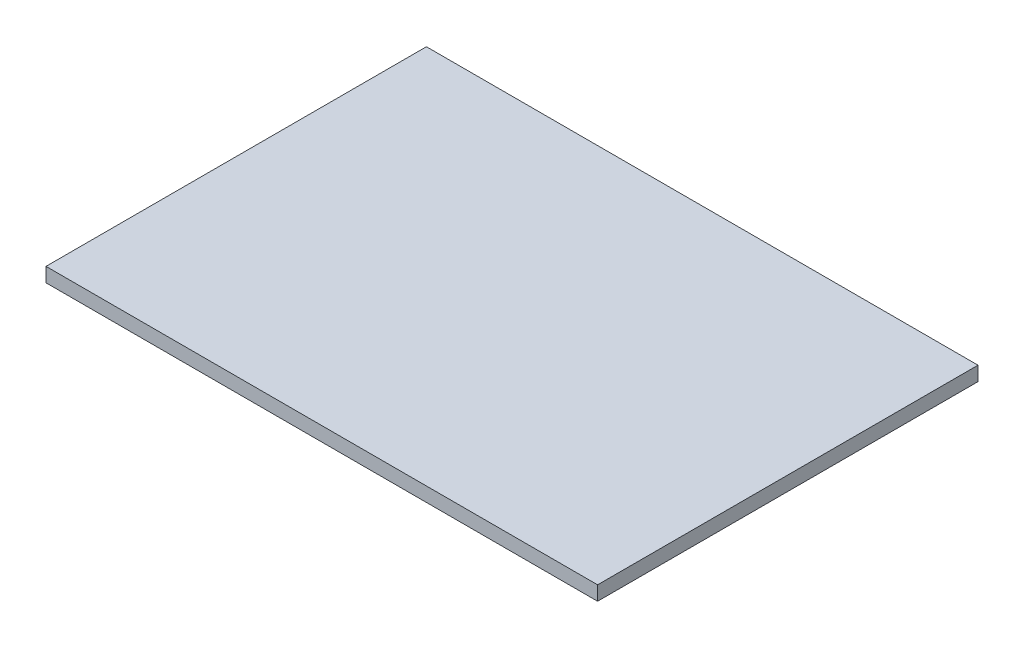
from build123d import *

# Parameters (mm, degrees)
SKETCH1_W           = 116
SKETCH1_H           = 80
BOSS_EXTRUDE1_DEPTH = 3


with BuildPart() as part:
    # Sketch1 → Boss-Extrude1 (new body)
    with BuildSketch(Plane(origin=(0, 0, 0), x_dir=(1, 0, 0), z_dir=(0, 1, 0))):
        with Locations((-40.561629855, 42.400283223)):
            Rectangle(SKETCH1_W, SKETCH1_H)
    extrude(amount=BOSS_EXTRUDE1_DEPTH)


solid = part.part
